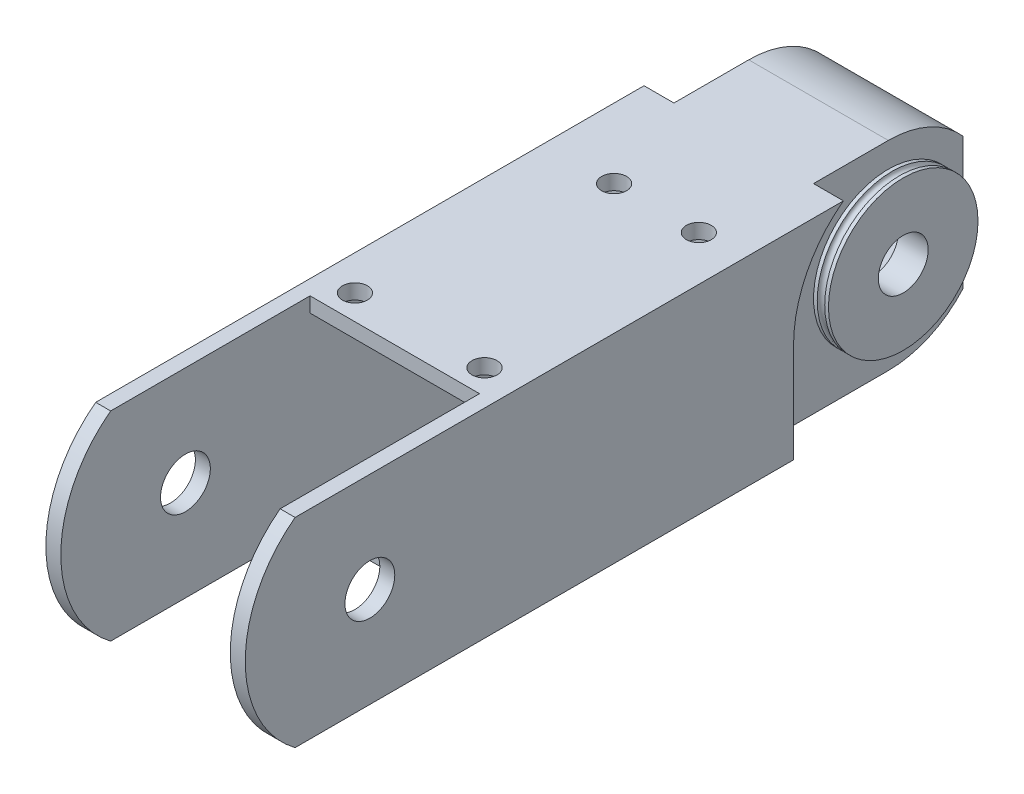
from build123d import *

# Parameters (mm, degrees)
CROQUIS1_W              = 40
CROQUIS1_H              = 40
SALIENTE_EXTRUIR1_DEPTH = 150
CROQUIS2_W              = 34
CROQUIS2_H              = 40
CORTAR_EXTRUIR1_DEPTH   = 50
CORTAR_EXTRUIR5_DEPTH   = 157.524758425
CROQUIS4_R              = 5
CORTAR_EXTRUIR6_DEPTH   = 157.524758425
CORTAR_EXTRUIR10_DEPTH  = 157.524758425
CROQUIS5_R              = 5
CORTAR_EXTRUIR7_DEPTH   = 157.524758425
CROQUIS6_R              = 5
CORTAR_EXTRUIR8_DEPTH   = 6
CORTAR_EXTRUIR11_START  = -6
CROQUIS9_R              = 5
CORTAR_EXTRUIR11_DEPTH  = 6
SALIENTE_EXTRUIR2_START = 3
CROQUIS10_R             = 15
CROQUIS10_R_2           = 5
SALIENTE_EXTRUIR2_DEPTH = 3
CROQUIS11_R             = 15
CROQUIS11_R_2           = 5
SALIENTE_EXTRUIR3_DEPTH = 3
CROQUIS12_R             = 0.75
CORTAR_EXTRUIR12_DEPTH  = 6
CORTAR_EXTRUIR13_START  = -6
CORTAR_EXTRUIR13_DEPTH  = 6
CROQUIS15_W             = 22
CROQUIS15_H             = 20.45751311
CORTAR_EXTRUIR14_DEPTH  = 153.643375225
CROQUIS16_W             = 34
CROQUIS16_H             = 34
CORTAR_EXTRUIR15_DEPTH  = 55
CROQUIS17_R             = 2.5
CORTAR_EXTRUIR16_DEPTH  = 157.524758425
CROQUIS18_R             = 2.5
CORTAR_EXTRUIR17_DEPTH  = 157.524758425


with BuildPart() as part:
    # Croquis1 → Saliente-Extruir1 (new body)
    with BuildSketch(Plane.XY):
        Rectangle(CROQUIS1_W, CROQUIS1_H)
    extrude(amount=SALIENTE_EXTRUIR1_DEPTH)

    # Croquis2 → Cortar-Extruir1 (cut)
    with BuildSketch(Plane.XY.offset(150)):
        Rectangle(CROQUIS2_W, CROQUIS2_H)
    extrude(amount=-CORTAR_EXTRUIR1_DEPTH, mode=Mode.SUBTRACT)

    # Croquis3 → Cortar-Extruir5 (cut, through all)
    with BuildSketch(Plane(origin=(20, 0, 0), x_dir=(0, 0, -1), z_dir=(1, 0, 0))):
        with BuildLine():
            ThreePointArc((-140, -20), (-147.360679775, -11.180339887), (-150, 0))
            Line((-150, 0), (-150, -20))
            Line((-150, -20), (-140, -20))
        make_face()
        with BuildLine():
            Line((-140, 20), (-150, 20))
            Line((-150, 20), (-150, 0))
            ThreePointArc((-150, 0), (-147.360679775, 11.180339887), (-140, 20))
        make_face()
    extrude(amount=-CORTAR_EXTRUIR5_DEPTH, mode=Mode.SUBTRACT)

    # Croquis4 → Cortar-Extruir6 (cut, through all)
    with BuildSketch(Plane(origin=(20, 0, 0), x_dir=(0, 0, -1), z_dir=(1, 0, 0))):
        with Locations((-125, 0)):
            Circle(CROQUIS4_R)
    extrude(amount=-CORTAR_EXTRUIR6_DEPTH, mode=Mode.SUBTRACT)

    # Croquis8 → Cortar-Extruir10 (cut, through all)
    with BuildSketch(Plane(origin=(20, 0, 0), x_dir=(0, 0, -1), z_dir=(1, 0, 0))):
        with BuildLine():
            Line((0, 20), (-15, 20))
            ThreePointArc((-15, 20), (-6.771243445, 18.228756555), (0, 13.228756555))
            Line((0, 13.228756555), (0, 20))
        make_face()
        with BuildLine():
            Line((0, -20), (0, -13.228756555))
            ThreePointArc((0, -13.228756555), (-6.771243445, -18.228756555), (-15, -20))
            Line((-15, -20), (0, -20))
        make_face()
    extrude(amount=-CORTAR_EXTRUIR10_DEPTH, mode=Mode.SUBTRACT)

    # Croquis5 → Cortar-Extruir7 (cut, through all)
    with BuildSketch(Plane(origin=(20, 0, 0), x_dir=(0, 0, -1), z_dir=(1, 0, 0))):
        with Locations((-15, 0)):
            Circle(CROQUIS5_R)
    extrude(amount=-CORTAR_EXTRUIR7_DEPTH, mode=Mode.SUBTRACT)

    # Croquis6 → Cortar-Extruir8 (cut)
    with BuildSketch(Plane(origin=(20, 0, 0), x_dir=(0, 0, -1), z_dir=(1, 0, 0))):
        with BuildLine():
            ThreePointArc((-30, 20), (-40, 0), (-30, -20))
            Line((-30, -20), (-15, -20))
            ThreePointArc((-15, -20), (-6.771243445, -18.228756555), (0, -13.228756555))
            Line((0, -13.228756555), (0, 13.228756555))
            ThreePointArc((0, 13.228756555), (-6.771243445, 18.228756555), (-15, 20))
            Line((-15, 20), (-30, 20))
        make_face()
        with Locations((-15, 0)):
            Circle(CROQUIS6_R, mode=Mode.SUBTRACT)
    extrude(amount=-CORTAR_EXTRUIR8_DEPTH, mode=Mode.SUBTRACT)

    # Croquis9 → Cortar-Extruir11 (cut)
    with BuildSketch(Plane.ZY.offset(20).offset(CORTAR_EXTRUIR11_START)):
        with BuildLine():
            ThreePointArc((30, -20), (40, 0), (30, 20))
            Line((30, 20), (15, 20))
            ThreePointArc((15, 20), (6.771243445, 18.228756555), (0, 13.228756555))
            Line((0, 13.228756555), (0, -13.228756555))
            ThreePointArc((0, -13.228756555), (6.771243445, -18.228756555), (15, -20))
            Line((15, -20), (30, -20))
        make_face()
        with Locations(Location((15, 0, 0), (0, 0, 180))):
            Circle(CROQUIS9_R, mode=Mode.SUBTRACT)
    extrude(amount=CORTAR_EXTRUIR11_DEPTH, mode=Mode.SUBTRACT)

    # Croquis10 → Saliente-Extruir2 (add)
    with BuildSketch(Plane(origin=(14, 0, 0), x_dir=(0, 0, -1), z_dir=(1, 0, 0)).offset(SALIENTE_EXTRUIR2_START)):
        with Locations((-15, 0)):
            Circle(CROQUIS10_R)
        with Locations((-15, 0)):
            Circle(CROQUIS10_R_2, mode=Mode.SUBTRACT)
    extrude(amount=-SALIENTE_EXTRUIR2_DEPTH)

    # Croquis11 → Saliente-Extruir3 (add)
    with BuildSketch(Plane.ZY.offset(14)):
        with Locations(Location((15, 0, 0), (0, 0, 180))):
            Circle(CROQUIS11_R)
        with Locations(Location((15, 0, 0), (0, 0, 180))):
            Circle(CROQUIS11_R_2, mode=Mode.SUBTRACT)
    extrude(amount=SALIENTE_EXTRUIR3_DEPTH)

    # Croquis12 → Cortar-Revolución1 (revolve, cut)
    with BuildSketch(Plane.XY.offset(15), mode=Mode.PRIVATE) as cortar_revoluci_n1_sk:
        with Locations((15.5, 15)):
            Circle(CROQUIS12_R)
        with Locations((-15.5, 15)):
            Circle(CROQUIS12_R)
    revolve(cortar_revoluci_n1_sk.sketch.rotate(Axis((-18, 0, 15), (1, 0, 0)), 270), axis=Axis((-18, 0, 15), (1, 0, 0)), mode=Mode.SUBTRACT)

    # Croquis13 → Cortar-Extruir12 (cut)
    with BuildSketch(Plane(origin=(20, 0, 0), x_dir=(0, 0, -1), z_dir=(1, 0, 0))):
        with BuildLine():
            Line((-40, 0), (-40, -20))
            Line((-40, -20), (-30, -20))
            ThreePointArc((-30, -20), (-37.360679775, -11.180339887), (-40, 0))
        make_face()
    extrude(amount=-CORTAR_EXTRUIR12_DEPTH, mode=Mode.SUBTRACT)

    # Croquis14 → Cortar-Extruir13 (cut)
    with BuildSketch(Plane.ZY.offset(20).offset(CORTAR_EXTRUIR13_START)):
        with BuildLine():
            Line((30, -20), (40, -20))
            Line((40, -20), (40, 0))
            ThreePointArc((40, 0), (37.360679775, -11.180339887), (30, -20))
        make_face()
    extrude(amount=CORTAR_EXTRUIR13_DEPTH, mode=Mode.SUBTRACT)

    # Croquis15 → Cortar-Extruir14 (cut, through all)
    with BuildSketch(Plane(origin=(0, 0, 0), x_dir=(-1, 0, 0), z_dir=(0, 0, -1))):
        Rectangle(CROQUIS15_W, CROQUIS15_H)
    extrude(amount=-CORTAR_EXTRUIR14_DEPTH, mode=Mode.SUBTRACT)

    # Croquis16 → Cortar-Extruir15 (cut)
    with BuildSketch(Plane.XY.offset(100)):
        Rectangle(CROQUIS16_W, CROQUIS16_H)
    extrude(amount=-CORTAR_EXTRUIR15_DEPTH, mode=Mode.SUBTRACT)

    # Croquis17 → Cortar-Extruir16 (cut, through all)
    with BuildSketch(Plane(origin=(0, 20, 0), x_dir=(1, 0, 0), z_dir=(0, 1, 0))):
        with Locations(Location((-13, -95, 0), (0, 0, 270))):
            Circle(CROQUIS17_R)
        with Locations(Location((13, -95, 0), (0, 0, 270))):
            Circle(CROQUIS17_R)
    extrude(amount=-CORTAR_EXTRUIR16_DEPTH, mode=Mode.SUBTRACT)

    # Croquis18 → Cortar-Extruir17 (cut, through all)
    with BuildSketch(Plane(origin=(0, 20, 0), x_dir=(1, 0, 0), z_dir=(0, 1, 0))):
        with Locations(Location((11, -50, 0), (0, 0, 270))):
            Circle(CROQUIS18_R)
        with Locations(Location((-6, -50, 0), (0, 0, 270))):
            Circle(CROQUIS18_R)
    extrude(amount=-CORTAR_EXTRUIR17_DEPTH, mode=Mode.SUBTRACT)


solid = part.part
